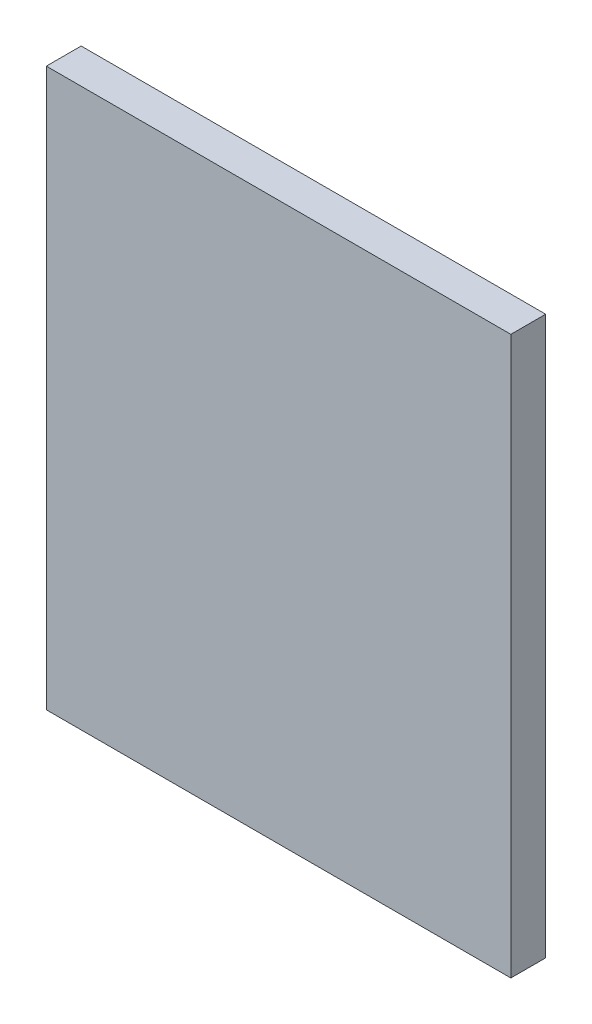
from build123d import *

# Parameters (mm, degrees)
SKETCH1_W           = 127
SKETCH1_H           = 152.4
BOSS_EXTRUDE1_DEPTH = 9.525


with BuildPart() as part:
    # Sketch1 → Boss-Extrude1 (new body)
    with BuildSketch(Plane.XY):
        with Locations((63.5, 76.2)):
            Rectangle(SKETCH1_W, SKETCH1_H)
    extrude(amount=BOSS_EXTRUDE1_DEPTH)


solid = part.part
